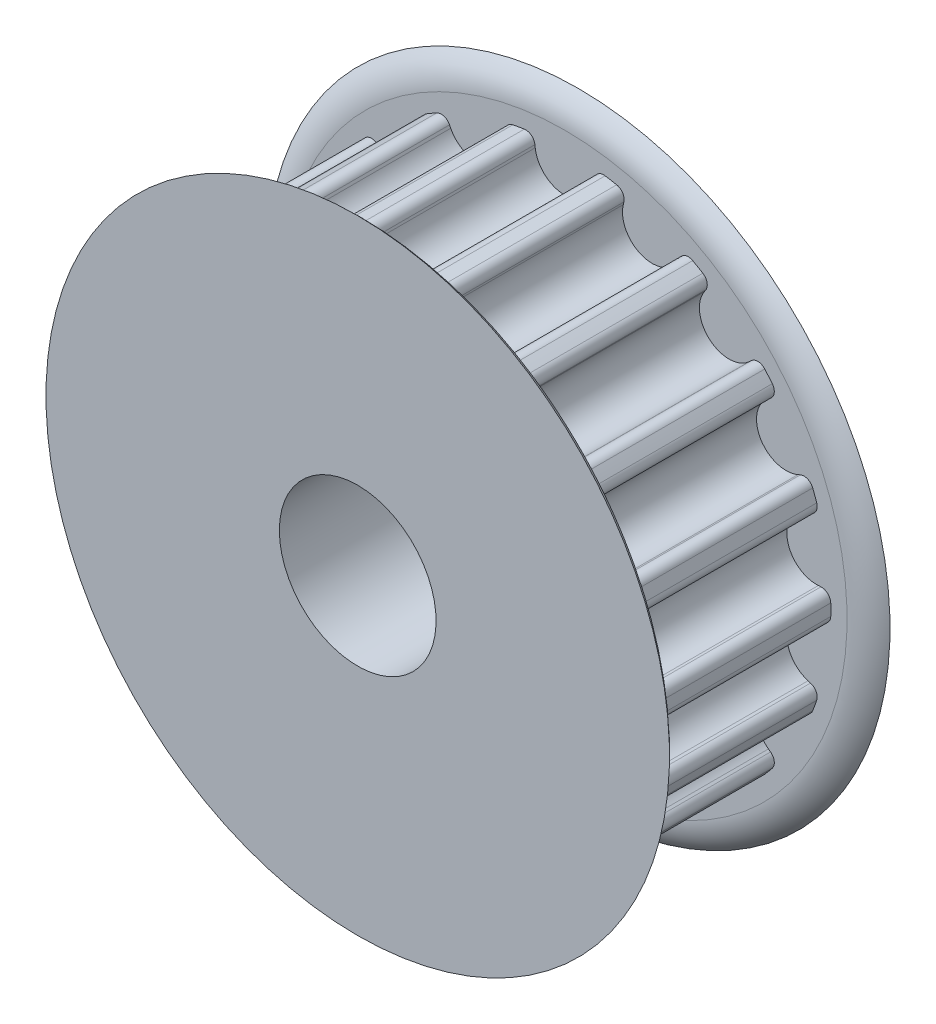
from build123d import *
from build123d.topology import SkipClean

# Parameters (mm, degrees)
SKETCH_3_R                       = 13.752444878
EXTRUDE_2_DEPTH                  = 5
CUT_EXTRUDE_2_DEPTH              = 21.081321676
FILLET_1_R                       = 0.48
PATTERN_CIRCULAR_1_COUNT         = 18
FILLET_1_OF_PATTERN_CIRCULAR_1_R = 0.48
SKETCH_4_R                       = 4.05
CUT_EXTRUDE_3_DEPTH              = 22.772520597
EXTRUDE_START                    = 5.7
SKETCH_5_R                       = 7
SKETCH_5_R_2                     = 4.05
EXTRUDE_3_DEPTH                  = 5.7
SKETCH_8_W                       = 1.2
SKETCH_8_H                       = 13.59826875


with BuildPart() as part:
    # 스케치3 → 보스-돌출2 (new, symmetric)
    with BuildSketch(Plane.XY):
        Circle(SKETCH_3_R)
    extrude(amount=EXTRUDE_2_DEPTH, both=True)

    # 스케치3<3> → 컷-돌출2 (cut, symmetric)
    with BuildSketch(Plane.XY):
        with BuildLine():
            Line((-1.597131903, 13.659389072), (-1.524613435, 13.039178578))
            ThreePointArc((-1.524613435, 13.039178578), (0, 11.682444878), (1.524613435, 13.039178578))
            Line((1.524613435, 13.039178578), (1.597131903, 13.659389072))
            ThreePointArc((1.597131903, 13.659389072), (0, 13.752444878), (-1.597131903, 13.659389072))
        make_face()
    cut_extrude_2 = extrude(amount=CUT_EXTRUDE_2_DEPTH, both=True, mode=Mode.SUBTRACT)

    # 필렛1
    fillet_1_edges = [part.edges().sort_by_distance(p)[0] for p in [
        (1.597131903, 13.659389072, 0),
        (-1.597131903, 13.659389072, 0),
    ]]
    fillet(fillet_1_edges, radius=FILLET_1_R)

    # 원형 패턴1: 컷-돌출2 ×18 about axis
    pattern_circular_1_axis = Axis((0, 0, 5), (0, 0, -1))
    for i in range(1, PATTERN_CIRCULAR_1_COUNT):
        add(cut_extrude_2.rotate(pattern_circular_1_axis, i * 360 / PATTERN_CIRCULAR_1_COUNT), mode=Mode.SUBTRACT)

    # 필렛1 of 원형 패턴1
    fillet_1_of_pattern_circular_1_edges = [part.edges().sort_by_distance(p)[0] for p in [
        (6.172599272, 12.289375833, 0),
        (3.170973145, 13.381878398, 0),
        (10.00356007, 9.437082497, 0),
        (7.556612032, 11.490315693, 0),
        (12.627943888, 5.446537735, 0),
        (11.030811985, 8.212851337, 0),
        (13.729211304, 0.79906014, 0),
        (13.174533215, 3.944795901, 0),
        (13.174533215, -3.944795901, 0),
        (13.729211304, -0.79906014, 0),
        (11.030811985, -8.212851337, 0),
        (12.627943888, -5.446537735, 0),
        (7.556612032, -11.490315693, 0),
        (10.00356007, -9.437082497, 0),
        (3.170973145, -13.381878398, 0),
        (6.172599272, -12.289375833, 0),
        (-1.597131903, -13.659389072, 0),
        (1.597131903, -13.659389072, 0),
        (-6.172599272, -12.289375833, 0),
        (-3.170973145, -13.381878398, 0),
        (-10.00356007, -9.437082497, 0),
        (-7.556612032, -11.490315693, 0),
        (-12.627943888, -5.446537735, 0),
        (-11.030811985, -8.212851337, 0),
        (-13.729211304, -0.79906014, 0),
        (-13.174533215, -3.944795901, 0),
        (-13.174533215, 3.944795901, 0),
        (-13.729211304, 0.79906014, 0),
        (-11.030811985, 8.212851337, 0),
        (-12.627943888, 5.446537735, 0),
        (-7.556612032, 11.490315693, 0),
        (-10.00356007, 9.437082497, 0),
        (-3.170973145, 13.381878398, 0),
        (-6.172599272, 12.289375833, 0),
    ]]
    fillet(fillet_1_of_pattern_circular_1_edges, radius=FILLET_1_OF_PATTERN_CIRCULAR_1_R)

    # 스케치4 → 컷-돌출3 (cut, through all)
    with BuildSketch(Plane(origin=(0, 0, -5), x_dir=(-1, 0, 0), z_dir=(0, 0, -1))):
        Circle(SKETCH_4_R)
    extrude(amount=-CUT_EXTRUDE_3_DEPTH, mode=Mode.SUBTRACT)

    # 스케치5 → 보스-돌출3 (add)
    with BuildSketch(Plane(origin=(0, 0, -5), x_dir=(-1, 0, 0), z_dir=(0, 0, -1)).offset(EXTRUDE_START)):
        Circle(SKETCH_5_R)
        Circle(SKETCH_5_R_2, mode=Mode.SUBTRACT)
    extrude(amount=-EXTRUDE_3_DEPTH)

    # 스케치8 → M3x0.5 탭을 위한 탭 드릴1 (revolve, cut)
    with BuildSketch(Plane(origin=(0, 0, -7.85), x_dir=(0, 0, -1), z_dir=(1, 0, 0))):
        with Locations((0.6, 6.799134375)):
            Rectangle(SKETCH_8_W, SKETCH_8_H)
    revolve(axis=Axis((0, -6.35, -7.85), (0, 1, 0)), mode=Mode.SUBTRACT)

    # 스케치9 → 회전1 (revolve)
    with SkipClean():  # the faces are left unmerged after this step: merging them gives an invalid solid
        with BuildSketch(Plane(origin=(0, 0, 0), x_dir=(0, 0, -1), z_dir=(1, 0, 0))):
            with BuildLine():
                Line((-5.7, 16.112561362), (-5.7, 4.05))
                Line((-5.7, 4.05), (-5, 4.05))
                Line((-5, 4.05), (-5, 14.592692947))
                ThreePointArc((-5, 14.592692947), (-5.183409788, 15.429352974), (-5.7, 16.112561362))
            make_face()
            with BuildLine():
                Line((5, 4.05), (5, 14.592692947))
                ThreePointArc((5, 14.592692947), (5.183409788, 15.429352974), (5.7, 16.112561362))
                Line((5.7, 16.112561362), (5.7, 4.05))
                Line((5.7, 4.05), (5, 4.05))
            make_face()
        revolve(axis=Axis((0, 0, 0), (0, 0, 1)))


solid = part.part
